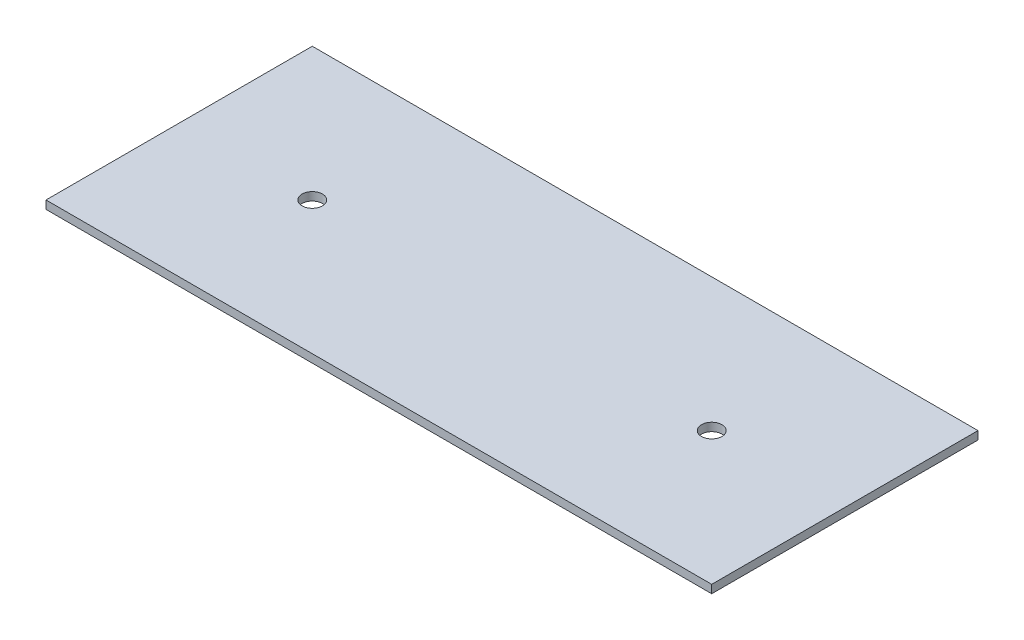
from build123d import *

# Parameters (mm, degrees)
SKETCH1_W           = 130
SKETCH1_H           = 52
SKETCH1_R           = 2
BOSS_EXTRUDE1_DEPTH = 1.6


with BuildPart() as part:
    # Sketch1 → Boss-Extrude1 (new body)
    with BuildSketch(Plane(origin=(0, 0, 0), x_dir=(1, 0, 0), z_dir=(0, 1, 0))):
        Rectangle(SKETCH1_W, SKETCH1_H)
        with Locations(Location((39, 0, 0), (0, 0, 270))):
            Circle(SKETCH1_R, mode=Mode.SUBTRACT)
        with Locations(Location((-39, 0, 0), (0, 0, 270))):
            Circle(SKETCH1_R, mode=Mode.SUBTRACT)
    extrude(amount=BOSS_EXTRUDE1_DEPTH)


solid = part.part
